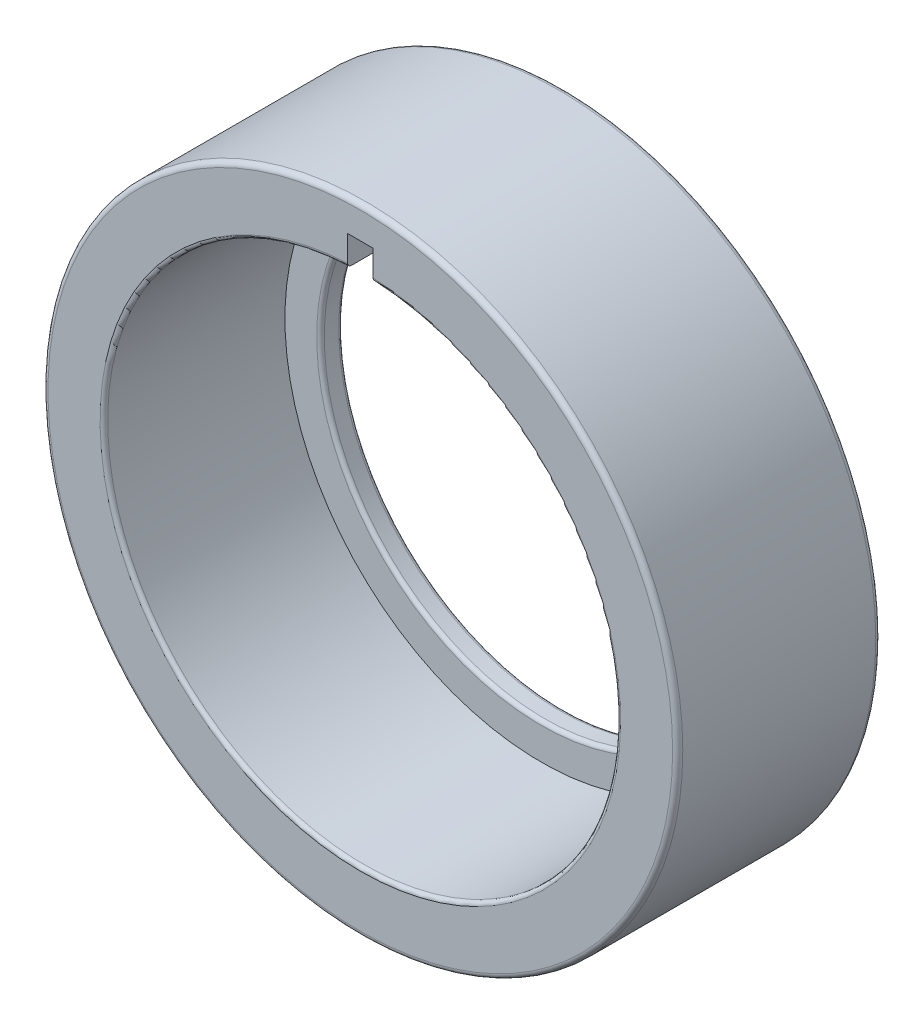
from build123d import *

# Parameters (mm, degrees)
SCHIZZO1_R                   = 125
SCHIZZO1_R_2                 = 101
ESTRUSIONE_ESTRUSIONE1_DEPTH = 80
RACCORDO1_R                  = 2
SCHIZZO3_R                   = 101
SCHIZZO3_R_2                 = 87
ESTRUSIONE_ESTRUSIONE2_DEPTH = 8.7
RACCORDO2_R                  = 1.5
SCHIZZO14_W                  = 10
SCHIZZO14_H                  = 35
TAGLIO_ESTRUSIONE1_DEPTH     = 71.3


with BuildPart() as part:
    # Schizzo1 → Estrusione-Estrusione1 (new body)
    with BuildSketch(Plane.XY):
        Circle(SCHIZZO1_R)
        Circle(SCHIZZO1_R_2, mode=Mode.SUBTRACT)
    extrude(amount=ESTRUSIONE_ESTRUSIONE1_DEPTH)

    # Raccordo1
    raccordo1_edges = [part.edges().sort_by_distance(p)[0] for p in [
        (-125, 0, 0),
        (-125, 0, 80),
    ]]
    fillet(raccordo1_edges, radius=RACCORDO1_R)

    # Schizzo3 → Estrusione-Estrusione2 (add)
    with BuildSketch(Plane.XY):
        Circle(SCHIZZO3_R)
        Circle(SCHIZZO3_R_2, mode=Mode.SUBTRACT)
    extrude(amount=ESTRUSIONE_ESTRUSIONE2_DEPTH)

    # Raccordo2
    raccordo2_edges = [part.edges().sort_by_distance(p)[0] for p in [
        (-87, 0, 0),
        (-87, 0, 8.7),
        (-101, 0, 80),
    ]]
    fillet(raccordo2_edges, radius=RACCORDO2_R)

    # Schizzo14 → Taglio-Estrusione1 (cut)
    with BuildSketch(Plane.XY.offset(80)):
        with Locations((0, 95)):
            Rectangle(SCHIZZO14_W, SCHIZZO14_H)
    extrude(amount=-TAGLIO_ESTRUSIONE1_DEPTH, mode=Mode.SUBTRACT)


solid = part.part
